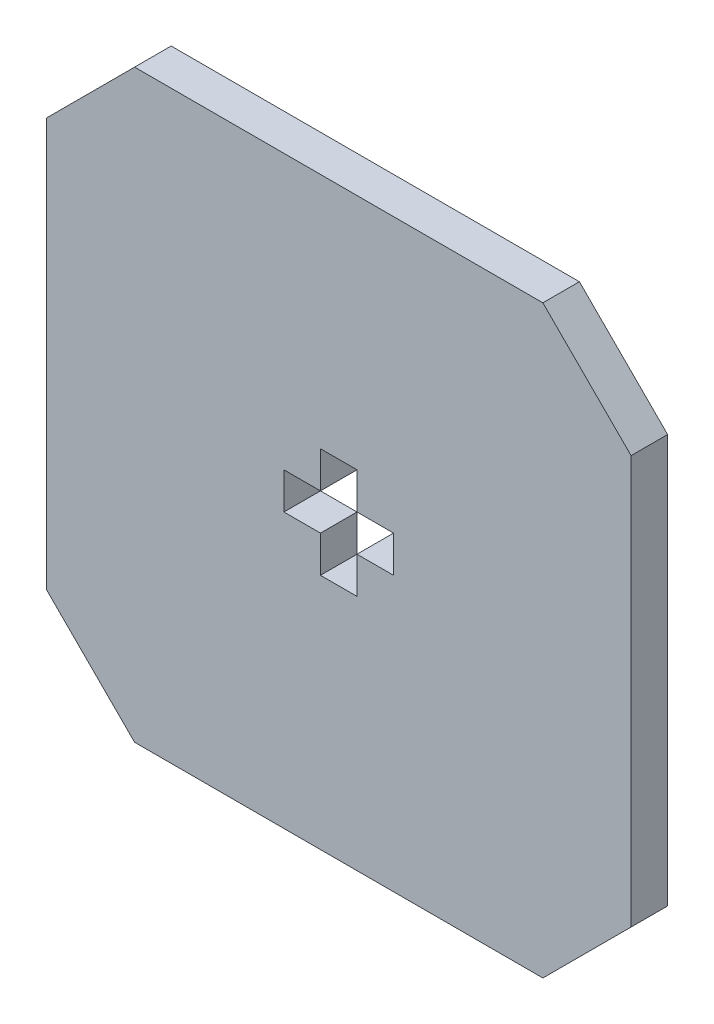
from build123d import *

# Parameters (mm, degrees)
BOSS_EXTRUDE1_DEPTH = 3


with BuildPart() as part:
    # Sketch1 → Boss-Extrude1 (new body)
    with BuildSketch(Plane.XY):
        Polygon((346.242645547, 248.99999521), (339.00000486, 256.242635897), (339.00000486, 289.757354523), (346.242645547, 296.99999521), (379.757364173, 296.99999521), (387.00000486, 289.757354523), (387.00000486, 256.242635897), (379.757364173, 248.99999521), align=None)
        Polygon((364.50000486, 277.49999521), (364.50000486, 274.49999521), (367.50000486, 274.49999521), (367.50000486, 271.49999521), (364.50000486, 271.49999521), (364.50000486, 268.49999521), (361.50000486, 268.49999521), (361.50000486, 271.49999521), (358.50000486, 271.49999521), (358.50000486, 274.49999521), (361.50000486, 274.49999521), (361.50000486, 277.49999521), align=None, mode=Mode.SUBTRACT)
    extrude(amount=BOSS_EXTRUDE1_DEPTH)


solid = part.part
